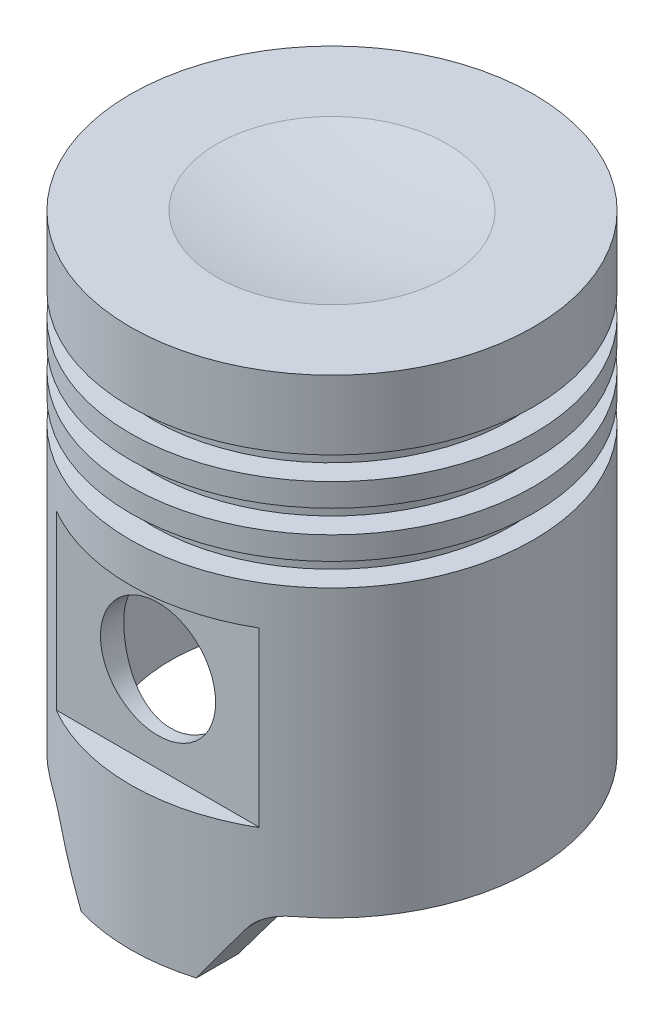
from build123d import *

# Parameters (mm, degrees)
SKETCH4_R               = 22.225
BOSS_EXTRUDE1_DEPTH     = 59.436
SKETCH5_W               = 2.54
SKETCH5_H               = 2.54
SKETCH6_R               = 17.78
CUT_EXTRUDE1_DEPTH      = 51.816
CUT_EXTRUDE3_DEPTH      = 68.23495628
CUT_EXTRUDE3_DEPTH_BACK = 68.23495628
CUT_EXTRUDE5_REACH      = 77.768
CUT_EXTRUDE5_END_RADIUS = 22.225
SKETCH12_W              = 22.352
SKETCH12_H              = 19.05
SKETCH13_R              = 6.35
CUT_EXTRUDE6_DEPTH      = 5.842


with BuildPart() as part:
    # Sketch4 → Boss-Extrude1 (new body)
    with BuildSketch(Plane(origin=(0, 0, 0), x_dir=(1, 0, 0), z_dir=(0, 1, 0))):
        with Locations(Location((0, 0, 0), (0, 0, 270))):
            Circle(SKETCH4_R)
    extrude(amount=-BOSS_EXTRUDE1_DEPTH)

    # Sketch5 → Cut-Revolve1 (revolve, cut)
    with BuildSketch(Plane.XY, mode=Mode.PRIVATE) as cut_revolve1_sk:
        with Locations((20.955, -8.89)):
            Rectangle(SKETCH5_W, SKETCH5_H)
        with Locations((20.955, -13.97)):
            Rectangle(SKETCH5_W, SKETCH5_H)
        with Locations((20.955, -19.05)):
            Rectangle(SKETCH5_W, SKETCH5_H)
    revolve(cut_revolve1_sk.sketch.rotate(Axis((0, 26.260199794, 0), (0, -1, 0)), 90), axis=Axis((0, 26.260199794, 0), (0, -1, 0)), mode=Mode.SUBTRACT)

    # Sketch6 → Cut-Extrude1 (cut)
    with BuildSketch(Plane.XZ.offset(59.436)):
        with Locations(Location((0, 0, 0), (0, 0, 270))):
            Circle(SKETCH6_R)
    extrude(amount=-CUT_EXTRUDE1_DEPTH, mode=Mode.SUBTRACT)

    # Sketch7 → Cut-Extrude3 (cut, two sides: drawn at the far end of the back side and taken through both)
    with BuildSketch(Plane.XY.offset(-CUT_EXTRUDE3_DEPTH_BACK)):
        with BuildLine():
            Line((22.225, -59.436), (22.225, -51.816))
            Line((22.225, -51.816), (13.459535823, -51.816))
            ThreePointArc((13.459535823, -51.816), (11.659833258, -52.274635573), (10.289790639, -53.52853315))
            Line((10.289790639, -53.52853315), (6.35, -59.436))
            Line((6.35, -59.436), (22.225, -59.436))
        make_face()
        with BuildLine():
            Line((-22.225, -59.436), (-6.35, -59.436))
            Line((-6.35, -59.436), (-10.289790639, -53.52853315))
            ThreePointArc((-10.289790639, -53.52853315), (-11.659833258, -52.274635573), (-13.459535823, -51.816))
            Line((-13.459535823, -51.816), (-22.225, -51.816))
            Line((-22.225, -51.816), (-22.225, -59.436))
        make_face()
    extrude(amount=CUT_EXTRUDE3_DEPTH + CUT_EXTRUDE3_DEPTH_BACK, mode=Mode.SUBTRACT)

    # Cut-Extrude5: up to this cylinder (the profile starts inside it)
    cut_extrude5_end = Plane(origin=(0, -34.178757, 0), z_dir=(0, 1, 0)) * Cylinder(CUT_EXTRUDE5_END_RADIUS, 200.986, mode=Mode.PRIVATE)
    # Sketch12 → Cut-Extrude5 (cut, up to the surface)
    with BuildSketch(Plane.XY.offset(19.177), mode=Mode.PRIVATE) as cut_extrude5_sk1:
        with Locations((0, -34.17875674)):
            Rectangle(SKETCH12_W, SKETCH12_H)
    cut_extrude5_tool1 = extrude(cut_extrude5_sk1.sketch, amount=CUT_EXTRUDE5_REACH, mode=Mode.PRIVATE) & cut_extrude5_end
    cut_extrude5 = cut_extrude5_tool1.solids().sort_by_distance((0, -34.178757, 19.177))[0]
    add(cut_extrude5, mode=Mode.SUBTRACT)

    # Sketch13 → Cut-Extrude6 (cut)
    with BuildSketch(Plane.XY.offset(19.177)):
        with Locations((0, -34.17875674)):
            Circle(SKETCH13_R)
    cut_extrude6 = extrude(amount=-CUT_EXTRUDE6_DEPTH, mode=Mode.SUBTRACT)

    # Mirror1: Cut-Extrude5, Cut-Extrude6 across plane
    add(cut_extrude5.mirror(Plane.XY), mode=Mode.SUBTRACT)
    add(cut_extrude6.mirror(Plane.XY), mode=Mode.SUBTRACT)

    # Sketch16 → Cut-Revolve2 (revolve, cut)
    with BuildSketch(Plane.XY, mode=Mode.PRIVATE) as cut_revolve2_sk:
        with BuildLine():
            Line((0, 0), (0, -1.27))
            ThreePointArc((0, -1.27), (6.387986381, -0.951711763), (12.712693656, 0))
            Line((12.712693656, 0), (0, 0))
        make_face()
    revolve(cut_revolve2_sk.sketch.rotate(Axis((0, 62.992, 0), (0, -1, 0)), 180), axis=Axis((0, 62.992, 0), (0, -1, 0)), mode=Mode.SUBTRACT)


solid = part.part
